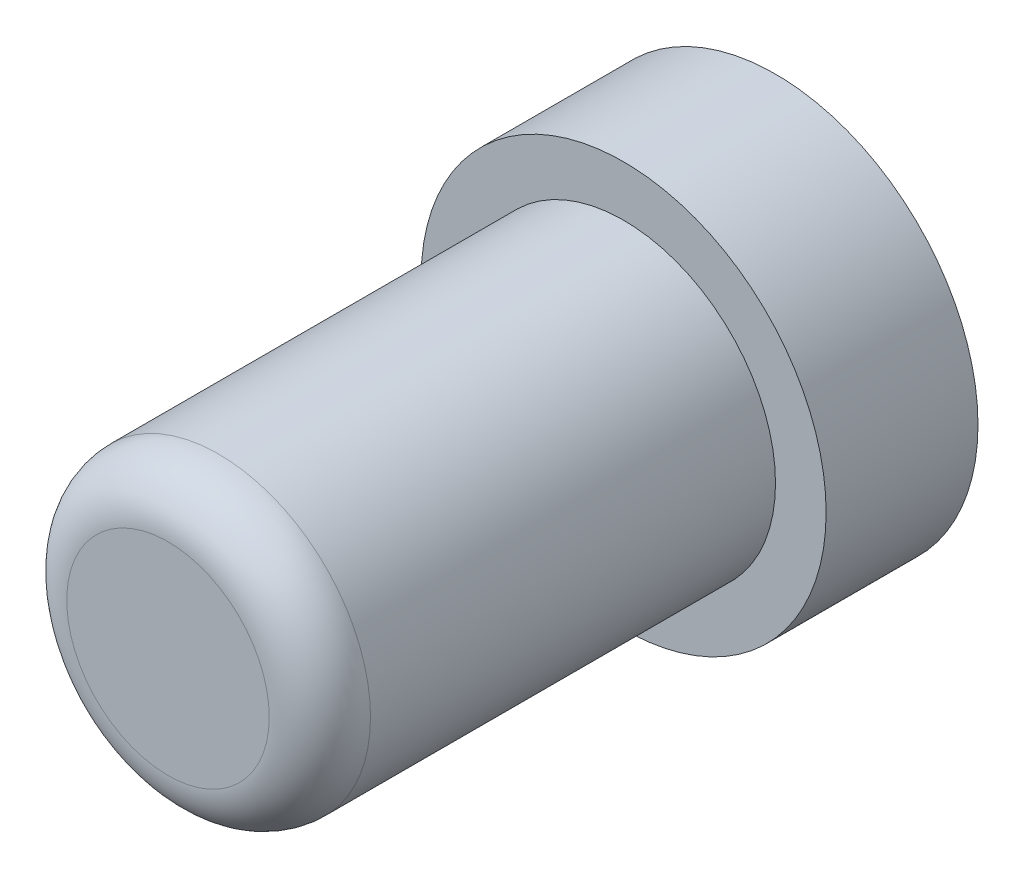
from build123d import *

# Parameters (mm, degrees)
SKETCH1_R           = 2
BOSS_EXTRUDE1_DEPTH = 1.5
SKETCH2_R           = 1.5
BOSS_EXTRUDE2_DEPTH = 4.5
FILLET1_R           = 0.5


with BuildPart() as part:
    # Sketch1 → Boss-Extrude1 (new body)
    with BuildSketch(Plane.XY):
        Circle(SKETCH1_R)
    extrude(amount=BOSS_EXTRUDE1_DEPTH)

    # Sketch2 → Boss-Extrude2 (add)
    with BuildSketch(Plane.XY.offset(1.5)):
        Circle(SKETCH2_R)
    extrude(amount=BOSS_EXTRUDE2_DEPTH)

    # Fillet1
    fillet1_edges = [part.edges().sort_by_distance(p)[0] for p in [
        (-1.5, 0, 6),
    ]]
    fillet(fillet1_edges, radius=FILLET1_R)


solid = part.part
